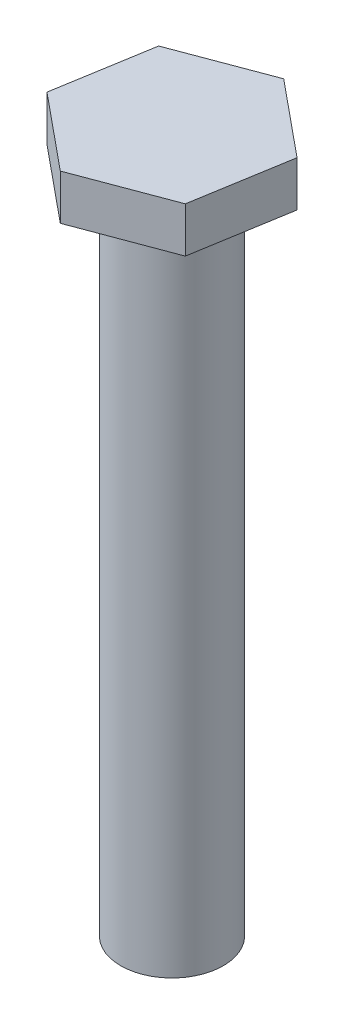
from build123d import *

# Parameters (mm, degrees)
SKETCH1_R   = 7.9375
SHAFT_DEPTH = 101.6
HEAD_DEPTH  = 7


with BuildPart() as part:
    # Sketch1 → Shaft (new body)
    with BuildSketch(Plane(origin=(0, 0, 0), x_dir=(1, 0, 0), z_dir=(0, 1, 0))):
        with Locations(Location((0, 0, 0), (0, 0, 270))):
            Circle(SKETCH1_R)
    extrude(amount=-SHAFT_DEPTH)

    # Sketch2 → Head (add)
    with BuildSketch(Plane(origin=(0, 0, 0), x_dir=(1, 0, 0), z_dir=(0, 1, 0))):
        Polygon((11.595031913, -9.533549616), (14.053812112, 5.274817386), (2.458780199, 14.808367002), (-11.595031913, 9.533549616), (-14.053812112, -5.274817386), (-2.458780199, -14.808367002), align=None)
    extrude(amount=HEAD_DEPTH)


solid = part.part
